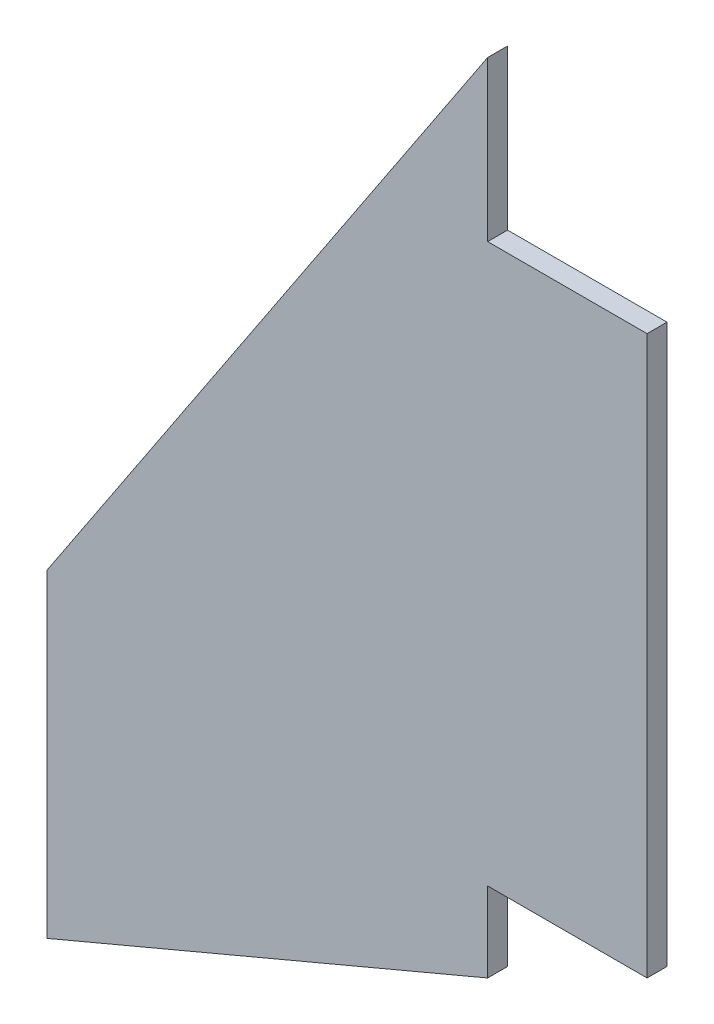
from build123d import *

# Parameters (mm, degrees)
BOSS_EXTRUDE1_DEPTH = 1.5875


with BuildPart() as part:
    # Sketch1 → Boss-Extrude1 (new, symmetric)
    with BuildSketch(Plane.XY):
        Polygon((0, 0), (0, 88.9), (-25.4, 88.9), (-25.4, 114.3), (-95.601891396, 8.466666667), (-95.601891396, -42.333333333), (-25.4, -12.7), (-25.4, 0), align=None)
    extrude(amount=BOSS_EXTRUDE1_DEPTH, both=True)


solid = part.part
